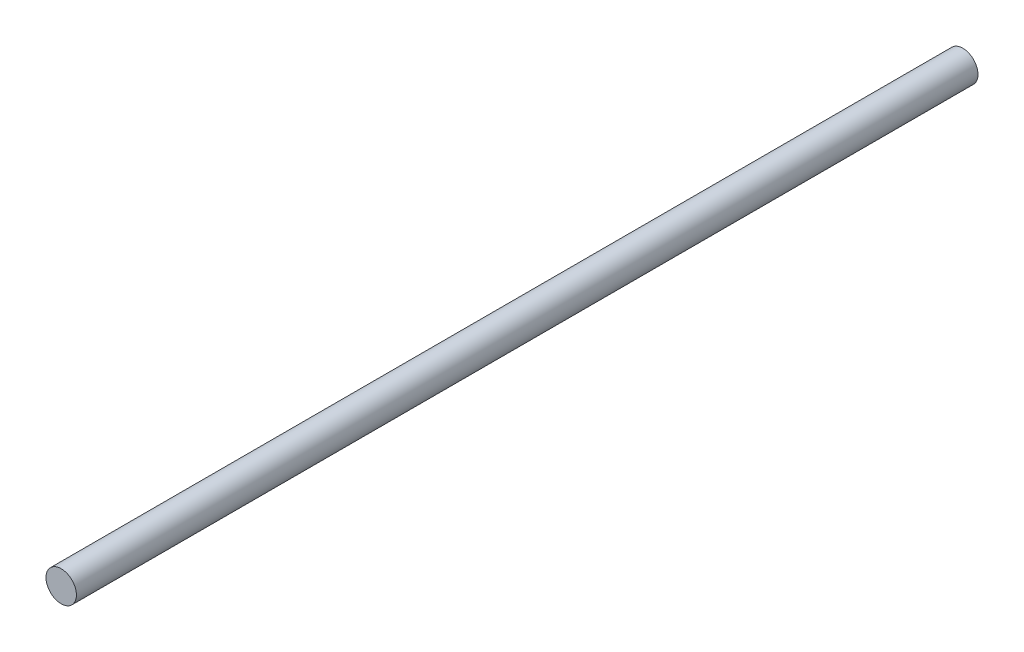
from build123d import *

# Parameters (mm, degrees)
SKETCH1_R           = 6
BOSS_EXTRUDE1_DEPTH = 355.6


with BuildPart() as part:
    # Sketch1 → Boss-Extrude1 (new body)
    with BuildSketch(Plane.XY):
        Circle(SKETCH1_R)
    extrude(amount=BOSS_EXTRUDE1_DEPTH)


solid = part.part
